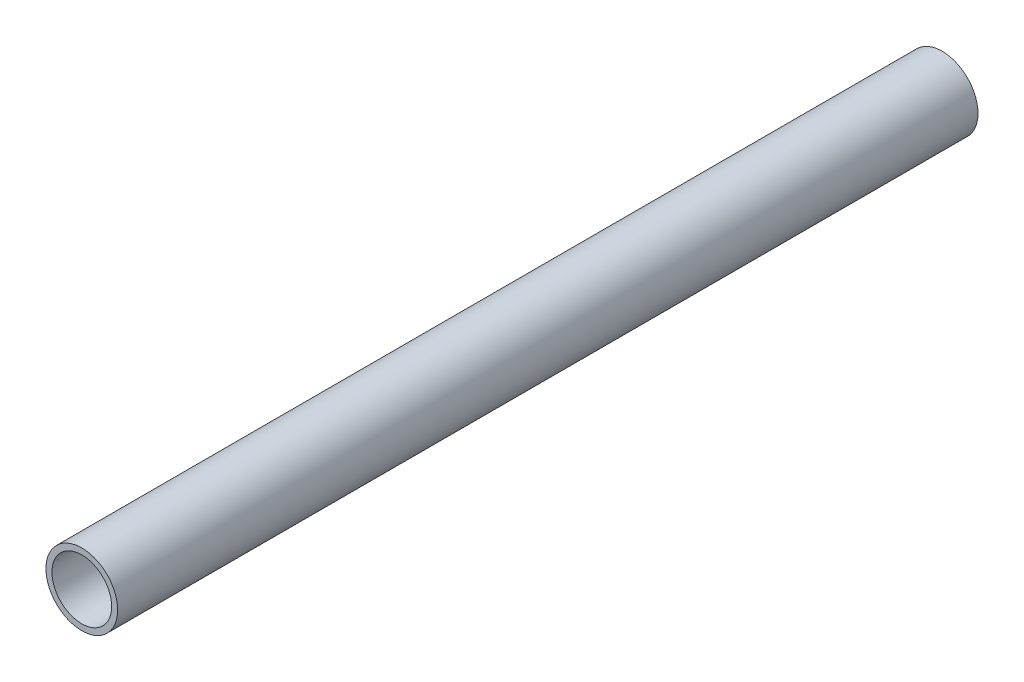
from build123d import *

# Parameters (mm, degrees)
SKETCH1_R           = 19.05
SKETCH1_R_2         = 15.875
BOSS_EXTRUDE1_DEPTH = 457.2


with BuildPart() as part:
    # Sketch1 → Boss-Extrude1 (new body)
    with BuildSketch(Plane.XY):
        Circle(SKETCH1_R)
        Circle(SKETCH1_R_2, mode=Mode.SUBTRACT)
    extrude(amount=BOSS_EXTRUDE1_DEPTH)


solid = part.part
